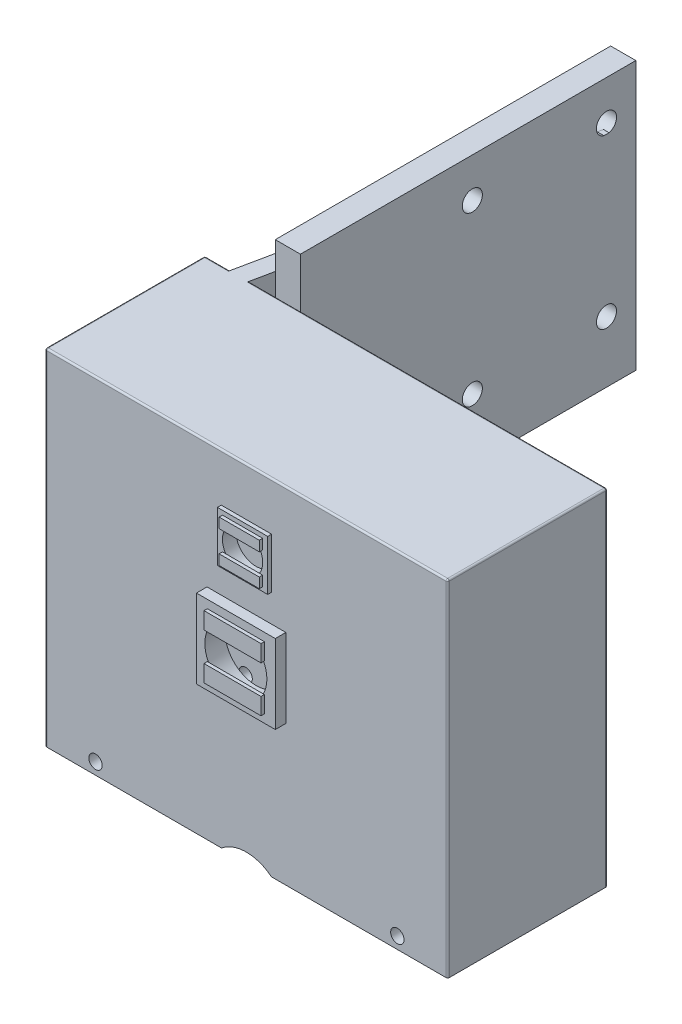
from build123d import *

# Parameters (mm, degrees)
SKETCH1_W               = 95.2
SKETCH1_H               = 205.7
BOSS_EXTRUDE1_DEPTH     = 240
SKETCH2_W               = 228.6
SKETCH2_H               = 83.8
CUT_EXTRUDE1_DEPTH      = 194.3
FILLET1_R               = 1
SKETCH3_R               = 18.5
CUT_EXTRUDE2_DEPTH      = 331.114419558
SKETCH4_W               = 47
SKETCH4_H               = 47
BOSS_EXTRUDE2_DEPTH     = 6.3
SKETCH6_W               = 47
SKETCH6_H               = 47
BOSS_EXTRUDE3_DEPTH     = 6.3
CUT_EXTRUDE3_DEPTH      = 332.986053924
CUT_EXTRUDE3_DEPTH_BACK = 332.986053924
SKETCH7_R               = 18.5
CUT_EXTRUDE4_DEPTH      = 332.986053924
CUT_EXTRUDE4_DEPTH_BACK = 332.986053924
SKETCH8_R               = 23.5
CUT_EXTRUDE5_DEPTH      = 332.986053924
CUT_EXTRUDE5_DEPTH_BACK = 332.986053924
SKETCH9_R               = 12
SKETCH10_W              = 30
SKETCH10_H              = 30
BOSS_EXTRUDE5_DEPTH     = 2.3
SKETCH11_W              = 30
SKETCH11_H              = 30
BOSS_EXTRUDE6_DEPTH     = 2.3
CUT_EXTRUDE6_DEPTH      = 332.986053924
CUT_EXTRUDE6_DEPTH_BACK = 332.986053924
SKETCH12_R              = 12
CUT_EXTRUDE7_DEPTH      = 332.986053924
CUT_EXTRUDE7_DEPTH_BACK = 332.986053924
SKETCH14_R              = 4
SKETCH15_W              = 34
SKETCH15_H              = 10
BOSS_EXTRUDE7_DEPTH     = 2
SKETCH17_W              = 34
SKETCH17_H              = 10
BOSS_EXTRUDE14_DEPTH    = 2
SKETCH18_W              = 24
SKETCH18_H              = 6
BOSS_EXTRUDE17_DEPTH    = 2
SKETCH19_W              = 24
SKETCH19_H              = 6
BOSS_EXTRUDE18_DEPTH    = 2
SKETCH20_W              = 15
SKETCH20_H              = 160
BOSS_EXTRUDE19_DEPTH    = 200
SKETCH21_R              = 6
CUT_EXTRUDE8_DEPTH      = 20
BOSS_EXTRUDE20_DEPTH    = 70


with BuildPart() as part:
    # Sketch1 → Boss-Extrude1 (new body)
    with BuildSketch(Plane(origin=(0, 0, 0), x_dir=(0, 0, -1), z_dir=(1, 0, 0))):
        with Locations((47.6, 102.85)):
            Rectangle(SKETCH1_W, SKETCH1_H)
    extrude(amount=-BOSS_EXTRUDE1_DEPTH)

    # Sketch2 → Cut-Extrude1 (cut)
    with BuildSketch(Plane.XZ):
        with Locations((-120, -47.6)):
            Rectangle(SKETCH2_W, SKETCH2_H)
    extrude(amount=-CUT_EXTRUDE1_DEPTH, mode=Mode.SUBTRACT)

    # Fillet1
    fillet1_edges = [part.edges().sort_by_distance(p)[0] for p in [
        (-240, 102.85, -95.2),
        (-240, 205.7, -47.6),
        (-240, 102.85, 0),
        (0, 205.7, -47.6),
        (0, 102.85, -95.2),
        (0, 102.85, 0),
        (-120, 205.7, 0),
        (-120, 205.7, -95.2),
    ]]
    fillet(fillet1_edges, radius=FILLET1_R)

    # Sketch3 → Cut-Extrude2 (cut, through all)
    with BuildSketch(Plane.XY):
        with Locations((-120, 107)):
            Circle(SKETCH3_R)
    extrude(amount=-CUT_EXTRUDE2_DEPTH, mode=Mode.SUBTRACT)

    # Sketch4 → Boss-Extrude2 (add)
    with BuildSketch(Plane.XY):
        with Locations((-120, 107)):
            Rectangle(SKETCH4_W, SKETCH4_H)
    extrude(amount=BOSS_EXTRUDE2_DEPTH)

    # Sketch6 → Boss-Extrude3 (add)
    with BuildSketch(Plane(origin=(0, 0, -95.2), x_dir=(-1, 0, 0), z_dir=(0, 0, -1))):
        with Locations((120, 107)):
            Rectangle(SKETCH6_W, SKETCH6_H)
    extrude(amount=BOSS_EXTRUDE3_DEPTH)

    # Sketch7 → Cut-Extrude3 (cut, two sides: drawn at the far end of the back side and taken through both)
    with BuildSketch(Plane.XY.offset(-CUT_EXTRUDE3_DEPTH_BACK)):
        with Locations((-120, 107)):
            Circle(SKETCH7_R)
    extrude(amount=CUT_EXTRUDE3_DEPTH + CUT_EXTRUDE3_DEPTH_BACK, mode=Mode.SUBTRACT)

    # Sketch8 → Cut-Extrude4 (cut, two sides: drawn at the far end of the back side and taken through both)
    with BuildSketch(Plane.XY.offset(-CUT_EXTRUDE4_DEPTH_BACK)):
        with Locations((-120, -18.2)):
            Circle(SKETCH8_R)
    extrude(amount=CUT_EXTRUDE4_DEPTH + CUT_EXTRUDE4_DEPTH_BACK, mode=Mode.SUBTRACT)

    # Sketch9 → Cut-Extrude5 (cut, two sides: drawn at the far end of the back side and taken through both)
    with BuildSketch(Plane.XY.offset(-CUT_EXTRUDE5_DEPTH_BACK)):
        with Locations((-120, 162)):
            Circle(SKETCH9_R)
    extrude(amount=CUT_EXTRUDE5_DEPTH + CUT_EXTRUDE5_DEPTH_BACK, mode=Mode.SUBTRACT)

    # Sketch10 → Boss-Extrude5 (add)
    with BuildSketch(Plane.XY):
        with Locations((-120, 162)):
            Rectangle(SKETCH10_W, SKETCH10_H)
    extrude(amount=BOSS_EXTRUDE5_DEPTH)

    # Sketch11 → Boss-Extrude6 (add)
    with BuildSketch(Plane(origin=(0, 0, -95.2), x_dir=(-1, 0, 0), z_dir=(0, 0, -1))):
        with Locations((120, 162)):
            Rectangle(SKETCH11_W, SKETCH11_H)
    extrude(amount=BOSS_EXTRUDE6_DEPTH)

    # Sketch12 → Cut-Extrude6 (cut, two sides: drawn at the far end of the back side and taken through both)
    with BuildSketch(Plane.XY.offset(-CUT_EXTRUDE6_DEPTH_BACK)):
        with Locations((-120, 162)):
            Circle(SKETCH12_R)
    extrude(amount=CUT_EXTRUDE6_DEPTH + CUT_EXTRUDE6_DEPTH_BACK, mode=Mode.SUBTRACT)

    # Sketch14 → Cut-Extrude7 (cut, two sides: drawn at the far end of the back side and taken through both)
    with BuildSketch(Plane.XY.offset(-CUT_EXTRUDE7_DEPTH_BACK)):
        with Locations((-30, 7)):
            Circle(SKETCH14_R)
        with Locations((-210, 7)):
            Circle(SKETCH14_R)
    extrude(amount=CUT_EXTRUDE7_DEPTH + CUT_EXTRUDE7_DEPTH_BACK, mode=Mode.SUBTRACT)

    # Sketch15 → Boss-Extrude7 (add)
    with BuildSketch(Plane(origin=(0, 0, -101.5), x_dir=(-1, 0, 0), z_dir=(0, 0, -1))):
        with Locations((120, 93.35)):
            Rectangle(SKETCH15_W, SKETCH15_H)
        with Locations((120, 120.65)):
            Rectangle(SKETCH15_W, SKETCH15_H)
    extrude(amount=BOSS_EXTRUDE7_DEPTH)

    # Sketch17 → Boss-Extrude14 (add)
    with BuildSketch(Plane.XY.offset(6.3)):
        with Locations((-120, 93.35)):
            Rectangle(SKETCH17_W, SKETCH17_H)
        with Locations((-120, 120.65)):
            Rectangle(SKETCH17_W, SKETCH17_H)
    extrude(amount=BOSS_EXTRUDE14_DEPTH)

    # Sketch18 → Boss-Extrude17 (add)
    with BuildSketch(Plane.XY.offset(2.3)):
        with Locations((-120, 152.5)):
            Rectangle(SKETCH18_W, SKETCH18_H)
        with Locations((-120, 171.5)):
            Rectangle(SKETCH18_W, SKETCH18_H)
    extrude(amount=BOSS_EXTRUDE17_DEPTH)

    # Sketch19 → Boss-Extrude18 (add)
    with BuildSketch(Plane(origin=(0, 0, -97.5), x_dir=(-1, 0, 0), z_dir=(0, 0, -1))):
        with Locations((120, 152.5)):
            Rectangle(SKETCH19_W, SKETCH19_H)
        with Locations((120, 171.5)):
            Rectangle(SKETCH19_W, SKETCH19_H)
    extrude(amount=BOSS_EXTRUDE18_DEPTH)

    # Sketch20 → Boss-Extrude19 (add)
    with BuildSketch(Plane(origin=(0, 0, -95.2), x_dir=(-1, 0, 0), z_dir=(0, 0, -1))):
        with Locations((190.5, 155)):
            Rectangle(SKETCH20_W, SKETCH20_H)
    extrude(amount=BOSS_EXTRUDE19_DEPTH)

    # Sketch21 → Cut-Extrude8 (cut)
    with BuildSketch(Plane.ZY.offset(198)):
        with Locations(Location((-277.7, 211.5, 0), (0, 0, 270))):
            Circle(SKETCH21_R)
        with Locations(Location((-197.7, 211.5, 0), (0, 0, 270))):
            Circle(SKETCH21_R)
        with Locations(Location((-277.7, 111.5, 0), (0, 0, 270))):
            Circle(SKETCH21_R)
        with Locations(Location((-197.7, 111.5, 0), (0, 0, 270))):
            Circle(SKETCH21_R)
    extrude(amount=-CUT_EXTRUDE8_DEPTH, mode=Mode.SUBTRACT)

    # Sketch22 → Boss-Extrude20 (add)
    with BuildSketch(Plane(origin=(0, 205.7, 0), x_dir=(1, 0, 0), z_dir=(0, 1, 0))):
        Polygon((-183, 295.2), (-225, 94.2), (-213.762423012, 94.2), (-183, 241.420167273), align=None)
    extrude(amount=-BOSS_EXTRUDE20_DEPTH)


solid = part.part
